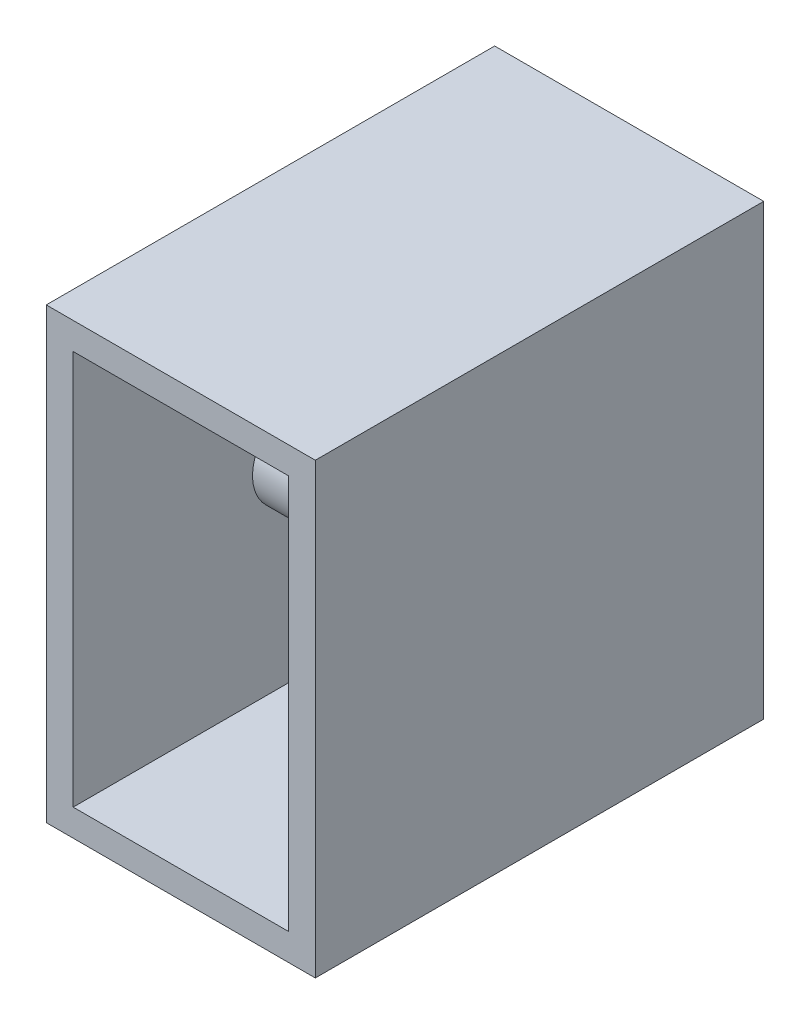
from build123d import *

# Parameters (mm, degrees)
SKETCH1_W           = 30
SKETCH1_H           = 50
SKETCH1_W_2         = 24
SKETCH1_H_2         = 44
EXTRUDE_THIN1_DEPTH = 50
BOSS_EXTRUDE1_REACH = 78.811
SKETCH2_R           = 5


with BuildPart() as part:
    # Sketch1 → Extrude-Thin1 (new body)
    with BuildSketch(Plane.XY):
        with Locations((15, 25)):
            Rectangle(SKETCH1_W, SKETCH1_H)
        with Locations((15, 25)):
            Rectangle(SKETCH1_W_2, SKETCH1_H_2, mode=Mode.SUBTRACT)
    extrude(amount=EXTRUDE_THIN1_DEPTH)

    # Sketch2 → Boss-Extrude1 (add, up to next)
    with BuildSketch(Plane(origin=(30, 0, 0), x_dir=(0, 0, -1), z_dir=(1, 0, 0)), mode=Mode.PRIVATE) as boss_extrude1_sk1:
        with Locations((-25, 25)):
            Circle(SKETCH2_R)
    boss_extrude1_tool1 = extrude(boss_extrude1_sk1.sketch, amount=-BOSS_EXTRUDE1_REACH, mode=Mode.PRIVATE) - part.part
    add(boss_extrude1_tool1.solids().sort_by_distance((30, 25, 25))[0])


solid = part.part
